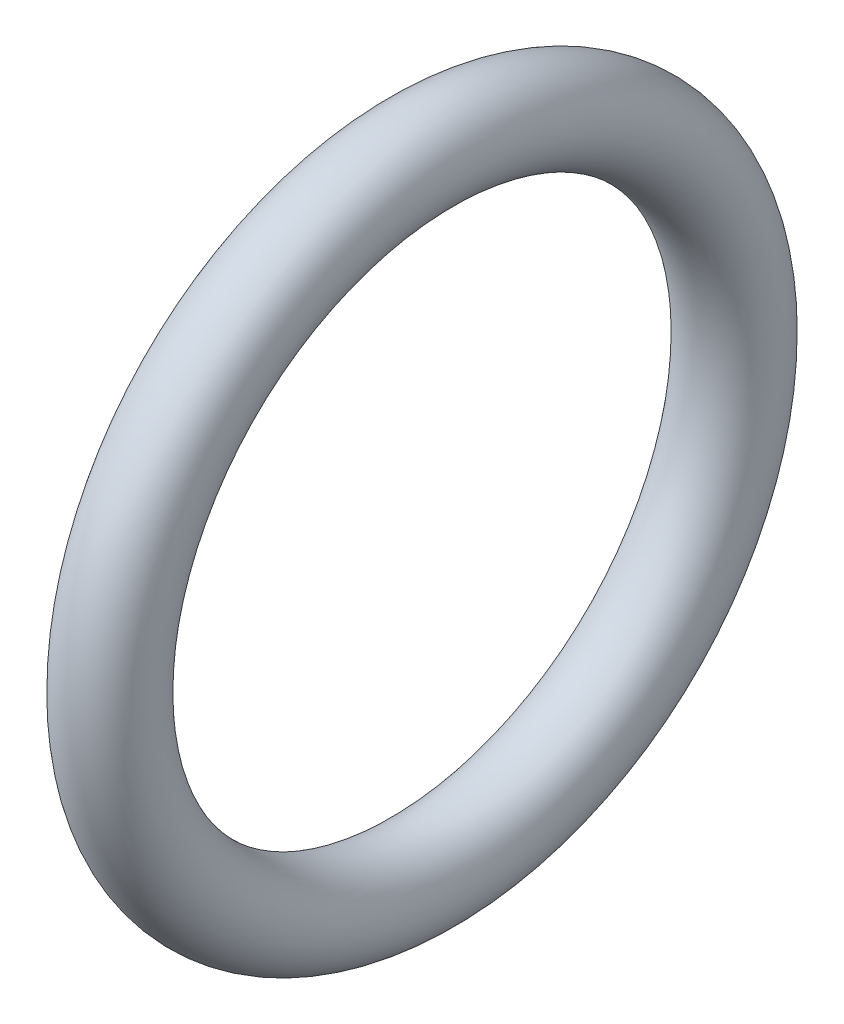
from build123d import *

# Parameters (mm, degrees)
SKETCH1_R = 31.75


with BuildPart() as part:
    # Sketch1 → Revolve1 (revolve)
    with BuildSketch(Plane.XY, mode=Mode.PRIVATE) as revolve1_sk:
        with Locations((0, 222.25)):
            Circle(SKETCH1_R)
    revolve(revolve1_sk.sketch.rotate(Axis((0, 0, 0), (1, 0, 0)), 90), axis=Axis((0, 0, 0), (1, 0, 0)))


solid = part.part
